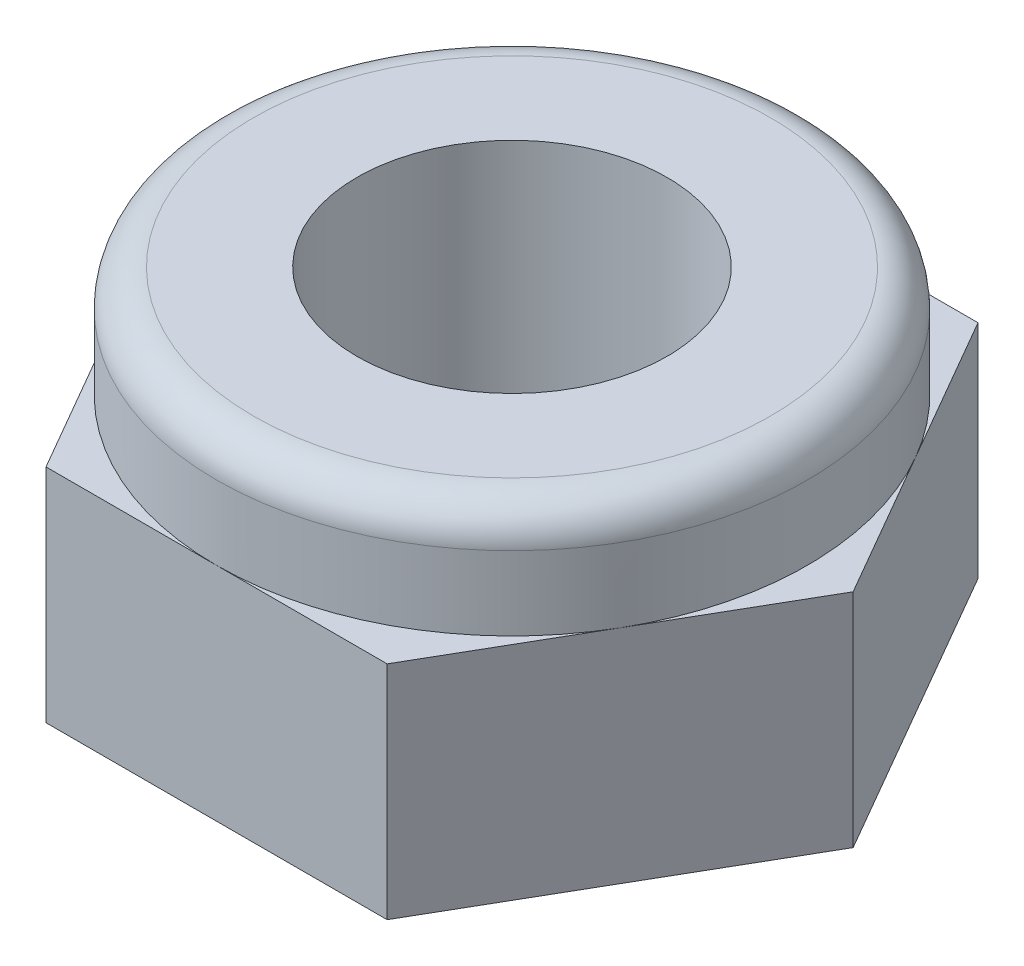
from build123d import *

# Parameters (mm, degrees)
BOSS_EXTRUDE1_DEPTH   = 3
SKETCH2_R             = 4
BOSS_EXTRUDE2_DEPTH   = 1.5
M5X0_8_TAPPED_HOLE1_D = 4.2
FILLET1_R             = 0.5


with BuildPart() as part:
    # Sketch1 → Boss-Extrude1 (new body)
    with BuildSketch(Plane(origin=(0, 0, 0), x_dir=(1, 0, 0), z_dir=(0, 1, 0))):
        Polygon((4.618802154, 0), (2.309401077, 4), (-2.309401077, 4), (-4.618802154, 0), (-2.309401077, -4), (2.309401077, -4), align=None)
    extrude(amount=BOSS_EXTRUDE1_DEPTH)

    # Sketch2 → Boss-Extrude2 (add)
    with BuildSketch(Plane(origin=(0, 3, 0), x_dir=(1, 0, 0), z_dir=(0, 1, 0))):
        with Locations(Location((0, 0, 0), (0, 0, 270))):
            Circle(SKETCH2_R)
    extrude(amount=BOSS_EXTRUDE2_DEPTH)

    # M5x0.8 Tapped Hole1 (through all)
    with Locations(Plane(origin=(0, 4.5, 0), x_dir=(1, 0, 0), z_dir=(0, 1, 0))):
        with Locations((0, 0)):
            Hole(M5X0_8_TAPPED_HOLE1_D / 2)

    # Fillet1
    fillet1_edges = [part.edges().sort_by_distance(p)[0] for p in [
        (0, 4.5, -4),
    ]]
    fillet(fillet1_edges, radius=FILLET1_R)


solid = part.part
